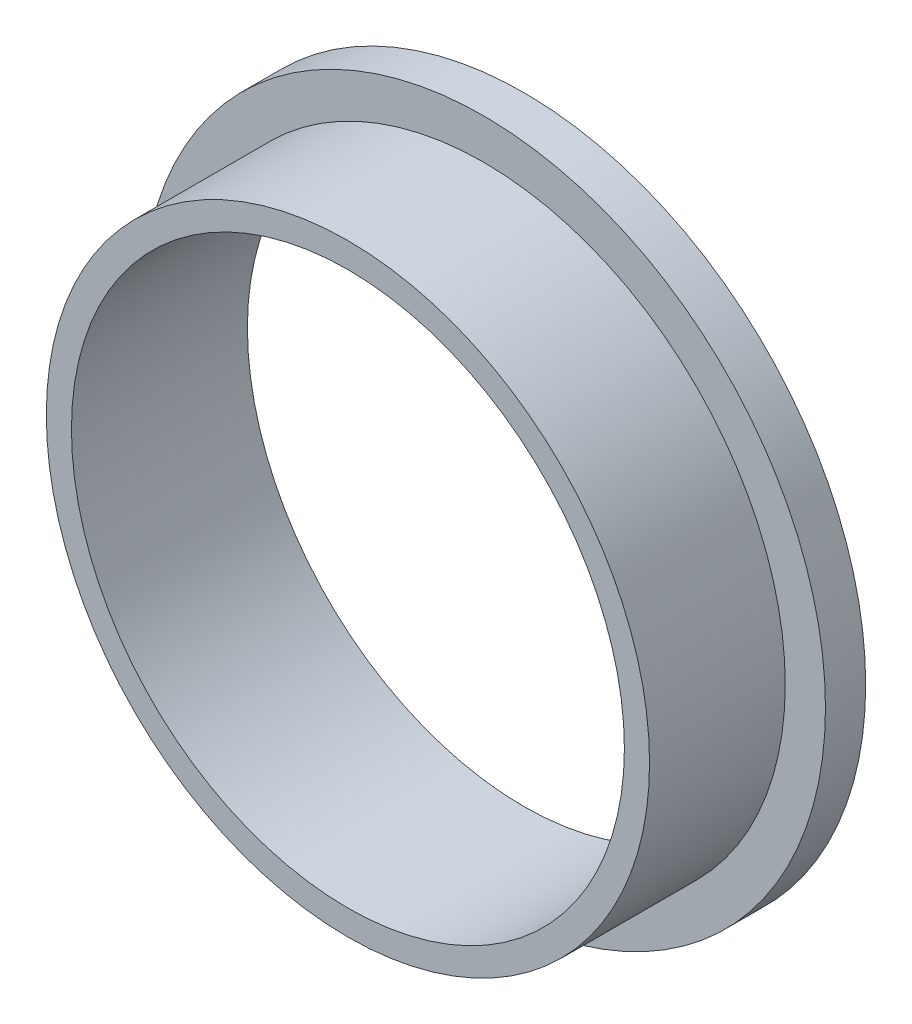
from build123d import *

# Parameters (mm, degrees)
SKETCH_1_R      = 6
SKETCH_1_R_2    = 5.5
EXTRUDE_1_DEPTH = 3.5
SKETCH_2_R      = 6.8
SKETCH_2_R_2    = 5.5
EXTRUDE_2_DEPTH = 0.8


with BuildPart() as part:
    # 草图1 → 凸台-拉伸1 (new body)
    with BuildSketch(Plane.XY):
        Circle(SKETCH_1_R)
        Circle(SKETCH_1_R_2, mode=Mode.SUBTRACT)
    extrude(amount=EXTRUDE_1_DEPTH)

    # 草图2 → 凸台-拉伸2 (add)
    with BuildSketch(Plane.XY):
        Circle(SKETCH_2_R)
        Circle(SKETCH_2_R_2, mode=Mode.SUBTRACT)
    extrude(amount=EXTRUDE_2_DEPTH)


solid = part.part
